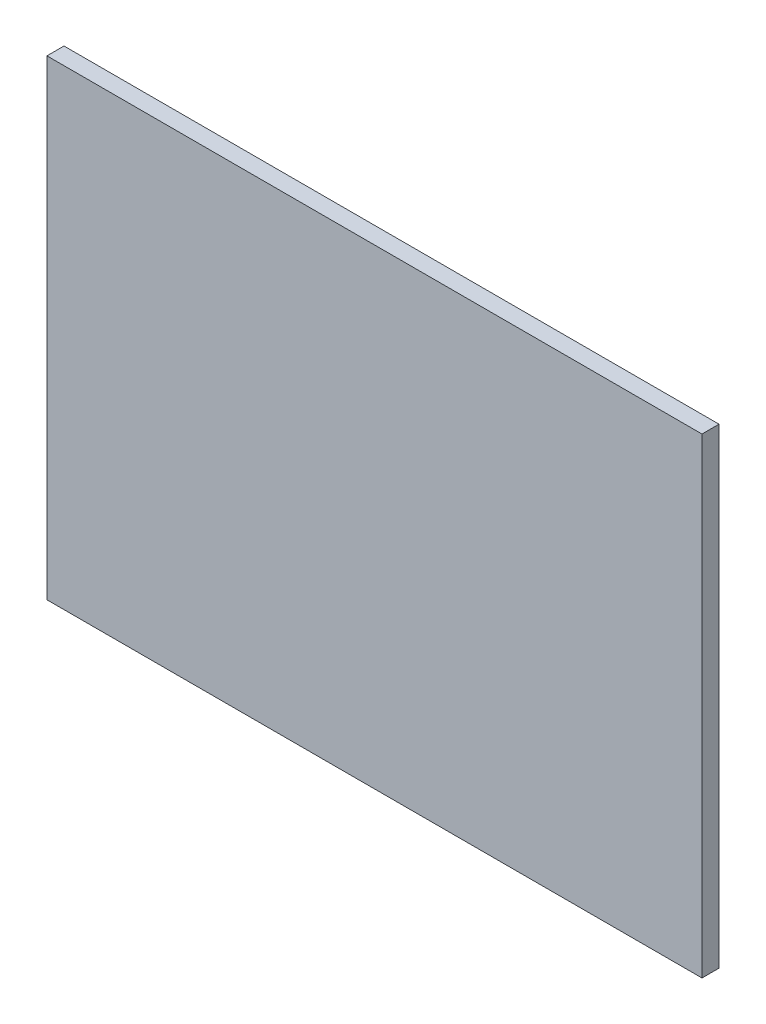
from build123d import *

# Parameters (mm, degrees)
SKETCH2_W           = 77.34
SKETCH2_H           = 87.37
BOSS_EXTRUDE1_DEPTH = 3.16
SKETCH_3_W          = 3.16
SKETCH_3_H          = 87.37
EXTRUDE_3_DEPTH     = 80
SKETCH_4_W          = 3.16
SKETCH_4_H          = 87.37
EXTRUDE_4_DEPTH     = 60
SKETCH_5_W          = 3.16
SKETCH_5_H          = 87.37
EXTRUDE_5_DEPTH     = 113
SKETCH_6_W          = 3.16
SKETCH_6_H          = 87.37
CUT_EXTRUDE_1_DEPTH = 17.86
SKETCH_8_R          = 12.75
CUT_EXTRUDE_2_DEPTH = 10
SKETCH_9_W          = 3.16
SKETCH_9_H          = 87.37
CUT_EXTRUDE_3_DEPTH = 171
SKETCH_10_W         = 3.16
SKETCH_10_H         = 87.37
CUT_EXTRUDE_4_DEPTH = 60
SKETCH_1_W          = 3.16
SKETCH_1_H          = 87.37
EXTRUDE_6_DEPTH     = 20
SKETCH_11_W         = 3.16
SKETCH_11_H         = 87.37
EXTRUDE_7_DEPTH     = 20


with BuildPart() as part:
    # Sketch2 → Boss-Extrude1 (new body)
    with BuildSketch(Plane.XY):
        with Locations((-14.294928595, 27.706753385)):
            Rectangle(SKETCH2_W, SKETCH2_H)
    extrude(amount=BOSS_EXTRUDE1_DEPTH)

    # 草图3 → 凸台-拉伸3 (add)
    with BuildSketch(Plane(origin=(24.375071405, 0, 0), x_dir=(0, 0, -1), z_dir=(1, 0, 0))):
        with Locations((-1.58, 27.706753385)):
            Rectangle(SKETCH_3_W, SKETCH_3_H)
    extrude(amount=EXTRUDE_3_DEPTH)

    # 草图4 → 凸台-拉伸4 (add)
    with BuildSketch(Plane.ZY.offset(52.964928595)):
        with Locations((1.58, 27.706753385)):
            Rectangle(SKETCH_4_W, SKETCH_4_H)
    extrude(amount=EXTRUDE_4_DEPTH)

    # 草图5 → 凸台-拉伸5 (add)
    with BuildSketch(Plane(origin=(104.375071405, 0, 0), x_dir=(0, 0, -1), z_dir=(1, 0, 0))):
        with Locations((-1.58, 27.706753385)):
            Rectangle(SKETCH_5_W, SKETCH_5_H)
    extrude(amount=EXTRUDE_5_DEPTH)

    # 草图6 → 切除-拉伸1 (cut)
    with BuildSketch(Plane(origin=(217.375071405, 0, 0), x_dir=(0, 0, -1), z_dir=(1, 0, 0))):
        with Locations((-1.58, 27.706753385)):
            Rectangle(SKETCH_6_W, SKETCH_6_H)
    extrude(amount=-CUT_EXTRUDE_1_DEPTH, mode=Mode.SUBTRACT)

    # 草图8 → 切除-拉伸2 (cut)
    with BuildSketch(Plane.XY.offset(3.16)):
        with Locations((175.79355983, 23.47529756)):
            Circle(SKETCH_8_R)
    extrude(amount=-CUT_EXTRUDE_2_DEPTH, mode=Mode.SUBTRACT)

    # 草图9 → 切除-拉伸3 (cut)
    with BuildSketch(Plane(origin=(199.515071405, 0, 0), x_dir=(0, 0, -1), z_dir=(1, 0, 0))):
        with Locations((-1.58, 27.706753385)):
            Rectangle(SKETCH_9_W, SKETCH_9_H)
    extrude(amount=-CUT_EXTRUDE_3_DEPTH, mode=Mode.SUBTRACT)

    # 草图10 → 切除-拉伸4 (cut)
    with BuildSketch(Plane.ZY.offset(112.964928595)):
        with Locations((1.58, 27.706753385)):
            Rectangle(SKETCH_10_W, SKETCH_10_H)
    extrude(amount=-CUT_EXTRUDE_4_DEPTH, mode=Mode.SUBTRACT)

    # 草图1 → 凸台-拉伸6 (add)
    with BuildSketch(Plane.ZY.offset(52.964928595)):
        with Locations((1.58, 27.706753385)):
            Rectangle(SKETCH_1_W, SKETCH_1_H)
    extrude(amount=EXTRUDE_6_DEPTH)

    # 草图11 → 凸台-拉伸7 (add)
    with BuildSketch(Plane(origin=(28.515071405, 0, 0), x_dir=(0, 0, -1), z_dir=(1, 0, 0))):
        with Locations((-1.58, 27.706753385)):
            Rectangle(SKETCH_11_W, SKETCH_11_H)
    extrude(amount=EXTRUDE_7_DEPTH)


solid = part.part
